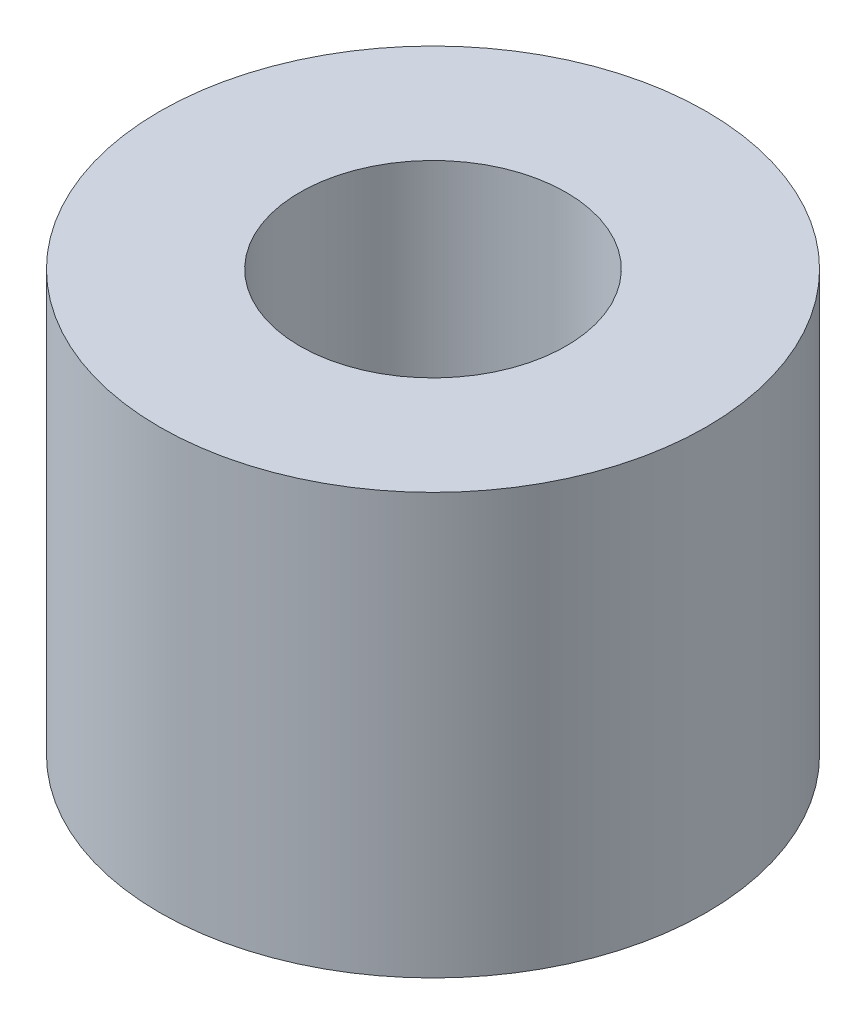
from build123d import *

# Parameters (mm, degrees)
SKETCH1_W = 2
SKETCH1_H = 6


with BuildPart() as part:
    # Sketch1 → Ojal_guia (revolve)
    with BuildSketch(Plane.XY, mode=Mode.PRIVATE) as ojal_guia_sk:
        with Locations((2.9, 0)):
            Rectangle(SKETCH1_W, SKETCH1_H)
    revolve(ojal_guia_sk.sketch.rotate(Axis((0, -7, 0), (0, 1, 0)), 90), axis=Axis((0, -7, 0), (0, 1, 0)))


solid = part.part
